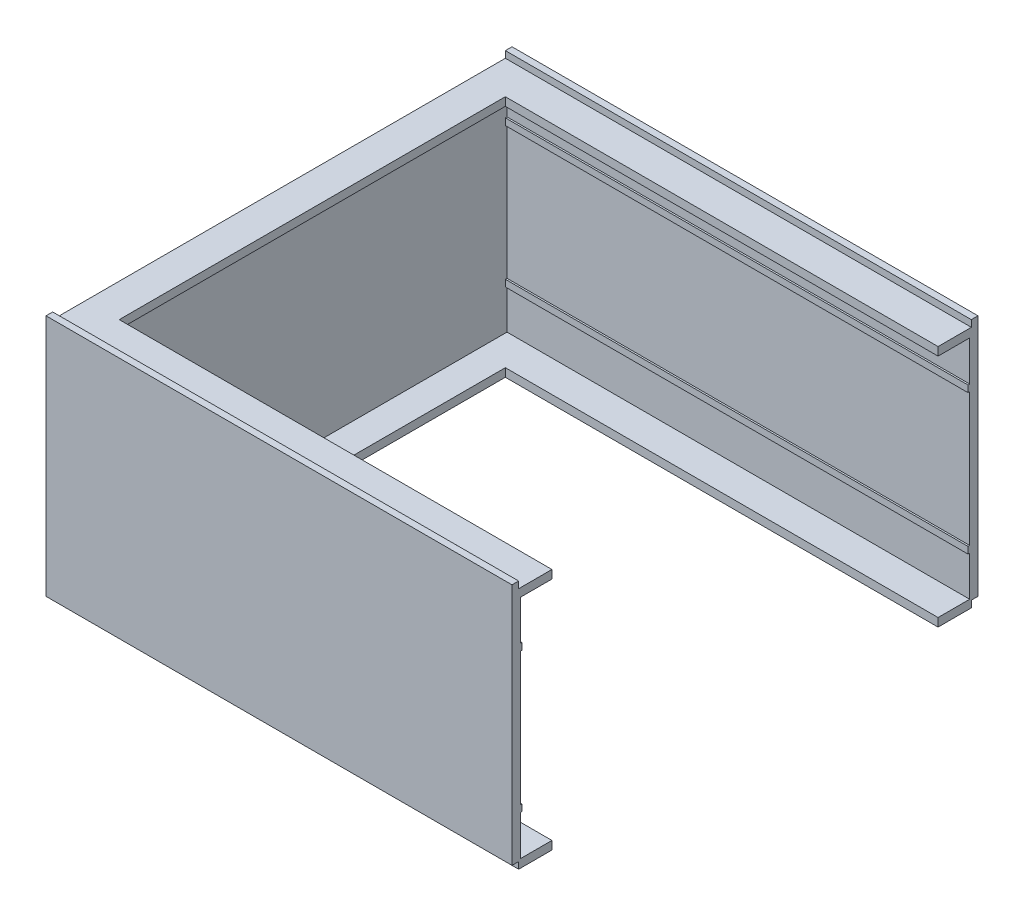
from build123d import *

# Parameters (mm, degrees)
SKETCH_1_W          = 280
SKETCH_1_H          = 280
EXTRUDE_1_DEPTH     = 150
SKETCH_2_W          = 280
SKETCH_2_H          = 272
CUT_EXTRUDE_1_DEPTH = 4
SKETCH_3_W          = 280
SKETCH_3_H          = 4
CUT_EXTRUDE_2_DEPTH = 4
SKETCH_4_W          = 270
SKETCH_4_H          = 136
CUT_EXTRUDE_3_DEPTH = 278
SKETCH_6_W          = 260
SKETCH_6_H          = 232
CUT_EXTRUDE_7_DEPTH = 247
EXTRUDE_START       = 140
SKETCH_7_W          = 1
SKETCH_7_H          = 4
EXTRUDE_2_DEPTH     = 278


with BuildPart() as part:
    # 草图1 → 凸台-拉伸1 (new body)
    with BuildSketch(Plane(origin=(0, 0, 0), x_dir=(1, 0, 0), z_dir=(0, 1, 0))):
        Rectangle(SKETCH_1_W, SKETCH_1_H)
    extrude(amount=EXTRUDE_1_DEPTH)

    # 草图2 → 切除-拉伸1 (cut)
    with BuildSketch(Plane(origin=(0, 150, 0), x_dir=(1, 0, 0), z_dir=(0, 1, 0))):
        Rectangle(SKETCH_2_W, SKETCH_2_H)
    extrude(amount=-CUT_EXTRUDE_1_DEPTH, mode=Mode.SUBTRACT)

    # 草图3 → 切除-拉伸2 (cut)
    with BuildSketch(Plane.XZ):
        with Locations((0, 138)):
            Rectangle(SKETCH_3_W, SKETCH_3_H)
        with Locations((0, -138)):
            Rectangle(SKETCH_3_W, SKETCH_3_H)
    extrude(amount=-CUT_EXTRUDE_2_DEPTH, mode=Mode.SUBTRACT)

    # 草图4 → 切除-拉伸3 (cut)
    with BuildSketch(Plane(origin=(140, 0, 0), x_dir=(0, 0, -1), z_dir=(1, 0, 0))):
        with Locations((0, 73)):
            Rectangle(SKETCH_4_W, SKETCH_4_H)
    extrude(amount=-CUT_EXTRUDE_3_DEPTH, mode=Mode.SUBTRACT)

    # 草图6 → 切除-拉伸7 (cut, through all)
    with BuildSketch(Plane(origin=(0, 146, 0), x_dir=(1, 0, 0), z_dir=(0, 1, 0))):
        with Locations((10, 0)):
            Rectangle(SKETCH_6_W, SKETCH_6_H)
    extrude(amount=-CUT_EXTRUDE_7_DEPTH, mode=Mode.SUBTRACT)

    # 草图7 → 凸台-拉伸2 (add)
    with BuildSketch(Plane(origin=(0, 0, 0), x_dir=(0, 0, -1), z_dir=(1, 0, 0)).offset(EXTRUDE_START)):
        with Locations((-134.5, 115)):
            Rectangle(SKETCH_7_W, SKETCH_7_H)
        with Locations((-134.5, 31)):
            Rectangle(SKETCH_7_W, SKETCH_7_H)
        with Locations((134.5, 31)):
            Rectangle(SKETCH_7_W, SKETCH_7_H)
        with Locations((134.5, 115)):
            Rectangle(SKETCH_7_W, SKETCH_7_H)
    extrude(amount=-EXTRUDE_2_DEPTH)


solid = part.part
